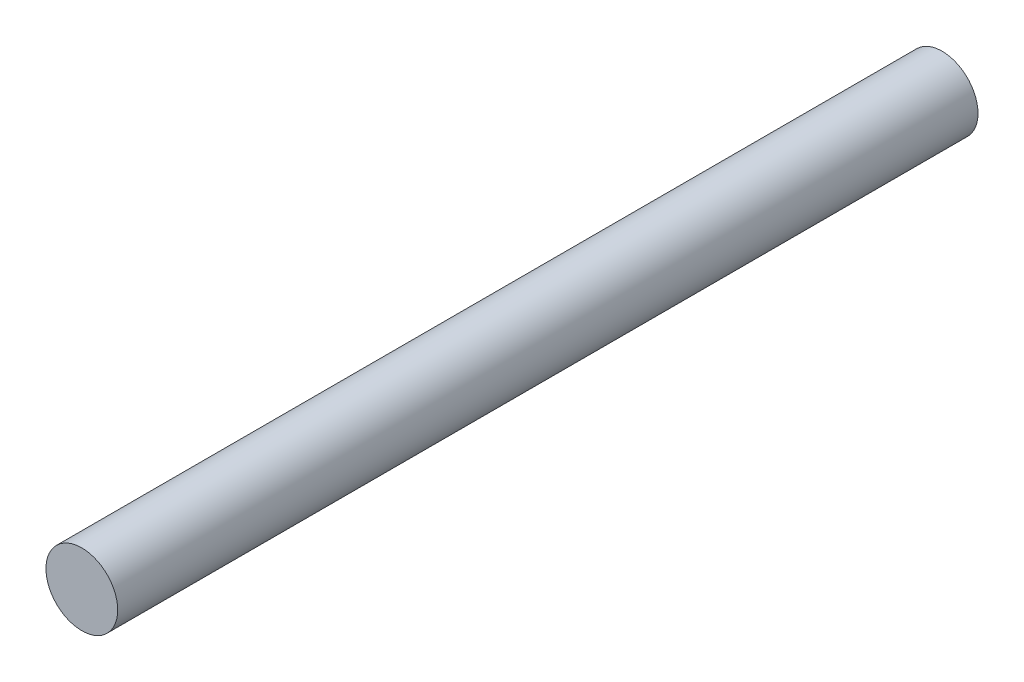
from build123d import *

# Parameters (mm, degrees)
ESQUISSE1_R        = 1.585
BOSS_EXTRU_1_DEPTH = 38


with BuildPart() as part:
    # Esquisse1 → Boss.-Extru.1 (new body)
    with BuildSketch(Plane.XY):
        Circle(ESQUISSE1_R)
    extrude(amount=BOSS_EXTRU_1_DEPTH)


solid = part.part
